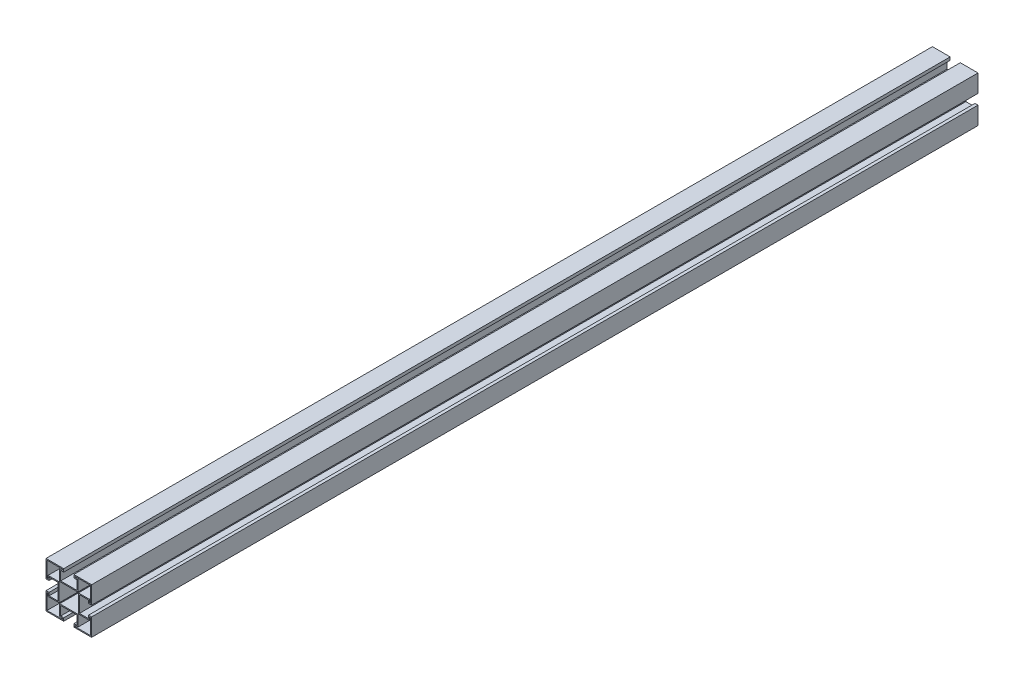
from build123d import *

# Parameters (mm, degrees)
BOSS_EXTRUDE2_DEPTH = 437.5


with BuildPart() as part:
    # Sketch1 → Boss-Extrude2 (new, symmetric)
    with BuildSketch(Plane.XY):
        Polygon((-5, 22.5), (-5, 19.5), (-8, 19.5), (-8, 10.5), (8, 10.5), (8, 19.5), (5, 19.5), (5, 22.5), (22.5, 22.5), (22.5, 5), (19.5, 5), (19.5, 8), (10.5, 8), (10.5, -8), (19.5, -8), (19.5, -5), (22.5, -5), (22.5, -22.5), (5, -22.5), (5, -19.5), (8, -19.5), (8, -10.5), (-8, -10.5), (-8, -19.5), (-5, -19.5), (-5, -22.5), (-22.5, -22.5), (-22.5, -5), (-19.5, -5), (-19.5, -8), (-10.5, -8), (-10.5, 8), (-19.5, 8), (-19.5, 5), (-22.5, 5), (-22.5, 22.5), align=None)
        Polygon((-6, 21.5), (-21.5, 21.5), (-21.5, 6), (-20.5, 6), (-20.5, 9), (-9.5, 9), (-9.5, -9), (-20.5, -9), (-20.5, -6), (-21.5, -6), (-21.5, -21.5), (-6, -21.5), (-6, -20.5), (-9, -20.5), (-9, -9.5), (9, -9.5), (9, -20.5), (6, -20.5), (6, -21.5), (21.5, -21.5), (21.5, -6), (20.5, -6), (20.5, -9), (9.5, -9), (9.5, 9), (20.5, 9), (20.5, 6), (21.5, 6), (21.5, 21.5), (6, 21.5), (6, 20.5), (9, 20.5), (9, 9.5), (-9, 9.5), (-9, 20.5), (-6, 20.5), align=None, mode=Mode.SUBTRACT)
    extrude(amount=BOSS_EXTRUDE2_DEPTH, both=True)


solid = part.part
